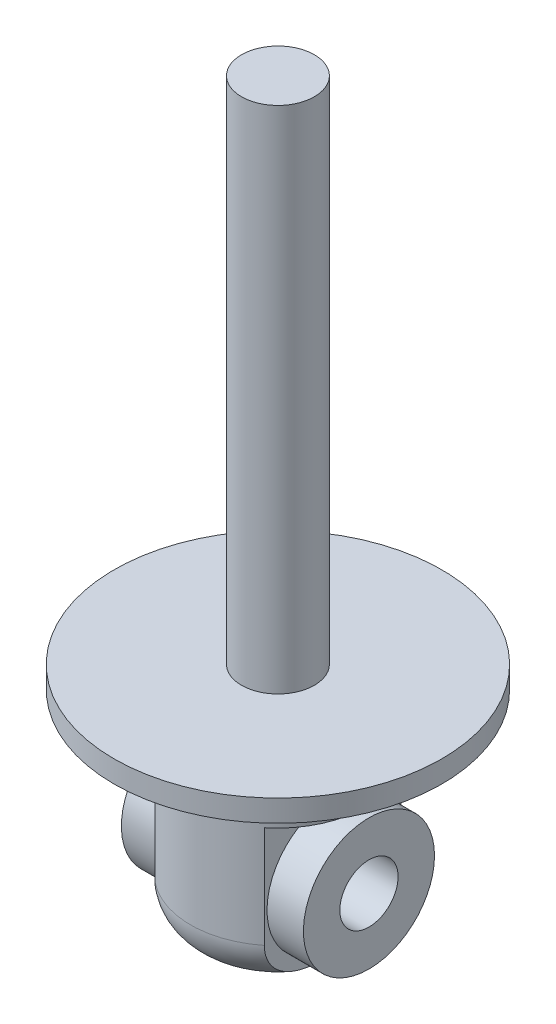
from build123d import *

# Parameters (mm, degrees)
SKETCH1_R               = 22.5
BOSS_EXTRUDE1_DEPTH     = 3
SKETCH2_R               = 5
BOSS_EXTRUDE2_DEPTH     = 70
SKETCH3_R               = 12
BOSS_EXTRUDE3_DEPTH     = 28
FILLET2_R               = 6
CUT_EXTRUDE4_DEPTH      = 80.633535649
CUT_EXTRUDE4_DEPTH_BACK = 80.633535649
SKETCH8_W               = 12.263816422
SKETCH8_H               = 20
CUT_EXTRUDE6_DEPTH      = 80.633535649
CUT_EXTRUDE6_DEPTH_BACK = 80.633535649
SKETCH11_R              = 4
SKETCH14_R              = 9
SKETCH14_R_2            = 4
BOSS_EXTRUDE8_DEPTH     = 12.5


with BuildPart() as part:
    # Sketch1 → Boss-Extrude1 (new body)
    with BuildSketch(Plane(origin=(0, 0, 0), x_dir=(1, 0, 0), z_dir=(0, 1, 0))):
        with Locations(Location((0, 0, 0), (0, 0, 270))):
            Circle(SKETCH1_R)
    extrude(amount=BOSS_EXTRUDE1_DEPTH)

    # Sketch2 → Boss-Extrude2 (add)
    with BuildSketch(Plane(origin=(0, 3, 0), x_dir=(1, 0, 0), z_dir=(0, 1, 0))):
        with Locations(Location((0, 0, 0), (0, 0, 270))):
            Circle(SKETCH2_R)
    extrude(amount=BOSS_EXTRUDE2_DEPTH)

    # Sketch3 → Boss-Extrude3 (add)
    with BuildSketch(Plane.XZ):
        with Locations(Location((0, 0, 0), (0, 0, 270))):
            Circle(SKETCH3_R)
    extrude(amount=BOSS_EXTRUDE3_DEPTH)

    # Fillet2
    fillet2_edges = [part.edges().sort_by_distance(p)[0] for p in [
        (0, -28, 12),
    ]]
    fillet(fillet2_edges, radius=FILLET2_R)

    # Sketch8 → Cut-Extrude4 (cut, two sides: drawn at the far end of the back side and taken through both)
    with BuildSketch(Plane.XY.offset(-CUT_EXTRUDE4_DEPTH_BACK)):
        with Locations((13.631908211, -18)):
            Rectangle(SKETCH8_W, SKETCH8_H)
        with Locations((-13.631908211, -18)):
            Rectangle(SKETCH8_W, SKETCH8_H)
    extrude(amount=CUT_EXTRUDE4_DEPTH + CUT_EXTRUDE4_DEPTH_BACK, mode=Mode.SUBTRACT)

    # Sketch11 → Cut-Extrude6 (cut, two sides: drawn at the far end of the back side and taken through both)
    with BuildSketch(Plane(origin=(0, 0, 0), x_dir=(0, 0, -1), z_dir=(1, 0, 0)).offset(-CUT_EXTRUDE6_DEPTH_BACK)):
        with Locations((0, -18)):
            Circle(SKETCH11_R)
    extrude(amount=CUT_EXTRUDE6_DEPTH + CUT_EXTRUDE6_DEPTH_BACK, mode=Mode.SUBTRACT)

    # Sketch14 → Boss-Extrude8 (add, symmetric)
    with BuildSketch(Plane(origin=(0, 0, 0), x_dir=(0, 0, -1), z_dir=(1, 0, 0))):
        with Locations(Location((0, -18, 0), (0, 0, 270))):
            Circle(SKETCH14_R)
        with Locations((0, -18)):
            Circle(SKETCH14_R_2, mode=Mode.SUBTRACT)
    extrude(amount=BOSS_EXTRUDE8_DEPTH, both=True)


solid = part.part
